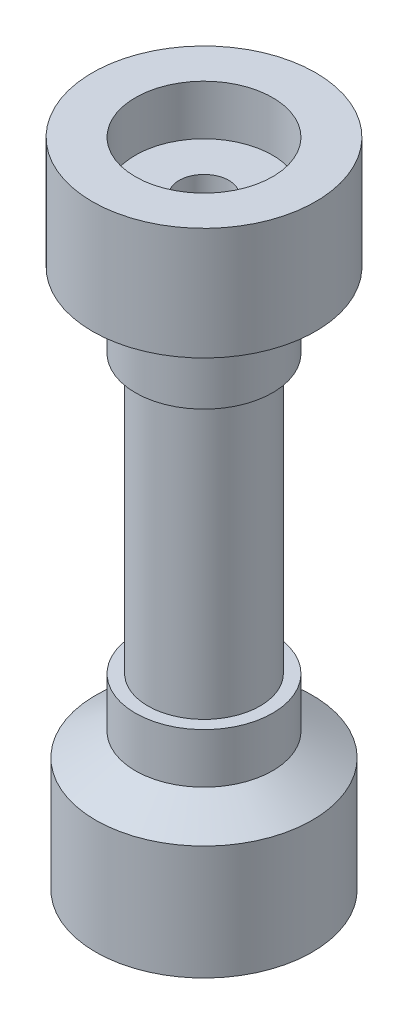
from build123d import *


with BuildPart() as part:
    # Sketch1 → Revolve3 (revolve)
    with BuildSketch(Plane(origin=(0, 0, 0), x_dir=(0, 0, -1), z_dir=(1, 0, 0))):
        Polygon((-27.711836567, 90.179694816), (-18.936694251, 85.113364038), (-18.936694251, 74.953364038), (-16.396694251, 74.953364038), (-16.396694251, 18.438364038), (-18.936694251, 18.438364038), (-18.936694251, 8.278364038), (-27.020934562, 3.610925718), (-27.020934562, -19.661635962), (-18.936694251, -19.661635962), (-18.936694251, -9.501635962), (-10.046694251, -9.501635962), (-10.046694251, 102.893364038), (-18.936694251, 102.893364038), (-18.936694251, 113.053364038), (-27.711836567, 113.053364038), align=None)
    revolve(axis=Axis((0, -21.28694113, 4.966694251), (0, -1, 0)))


solid = part.part
